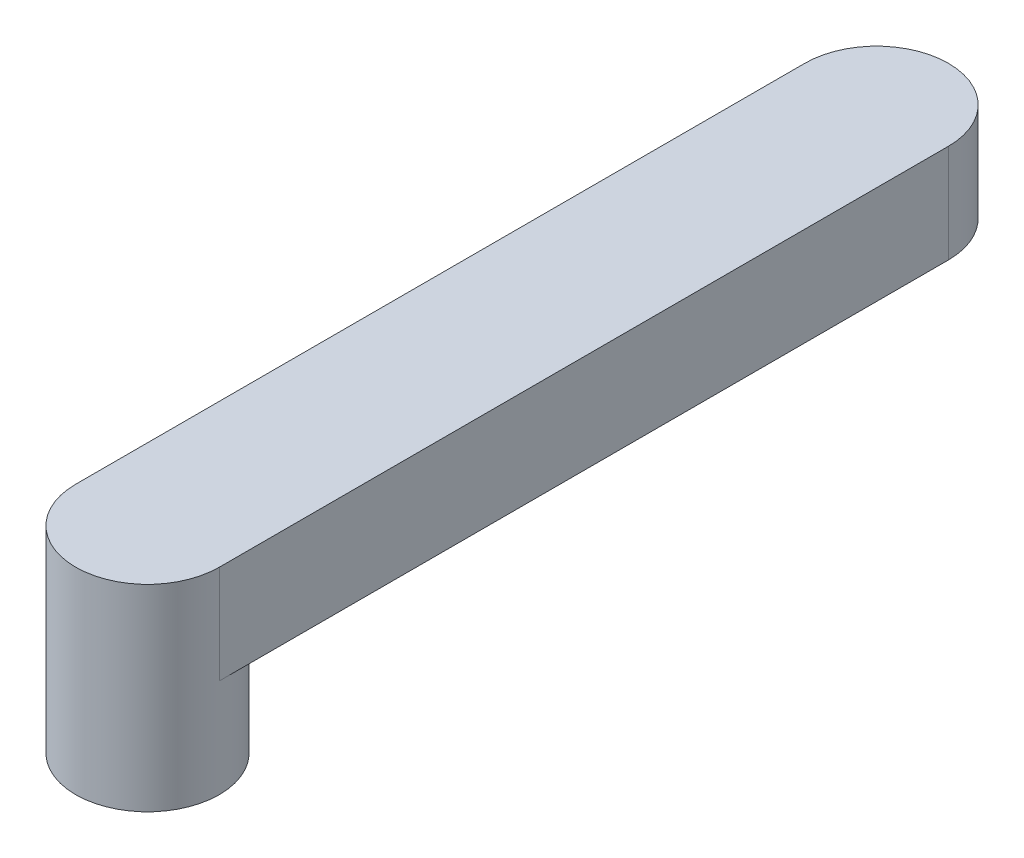
from build123d import *

# Parameters (mm, degrees)
BOSS_EXTRUDE1_DEPTH = 3.048
BOSS_EXTRUDE2_DEPTH = 3.048


with BuildPart() as part:
    # Sketch1 → Boss-Extrude1 (new body)
    with BuildSketch(Plane(origin=(0, 0, 0), x_dir=(1, 0, 0), z_dir=(0, 1, 0))):
        with BuildLine():
            Line((-2.2225, 10.16), (-2.2225, -12.397935732))
            ThreePointArc((-2.2225, -12.397935732), (0, -10.175435732), (2.2225, -12.397935732))
            Line((2.2225, -12.397935732), (2.2225, 10.16))
            ThreePointArc((2.2225, 10.16), (0, 12.3825), (-2.2225, 10.16))
        make_face()
    extrude(amount=BOSS_EXTRUDE1_DEPTH)

    # Sketch1<3> → Boss-Extrude2 (add, symmetric)
    with BuildSketch(Plane(origin=(0, 0, 0), x_dir=(1, 0, 0), z_dir=(0, 1, 0))):
        with BuildLine():
            ThreePointArc((-2.2225, -12.397935732), (0, -14.620435732), (2.2225, -12.397935732))
            ThreePointArc((2.2225, -12.397935732), (0, -10.175435732), (-2.2225, -12.397935732))
        make_face()
    extrude(amount=BOSS_EXTRUDE2_DEPTH, both=True)


solid = part.part
